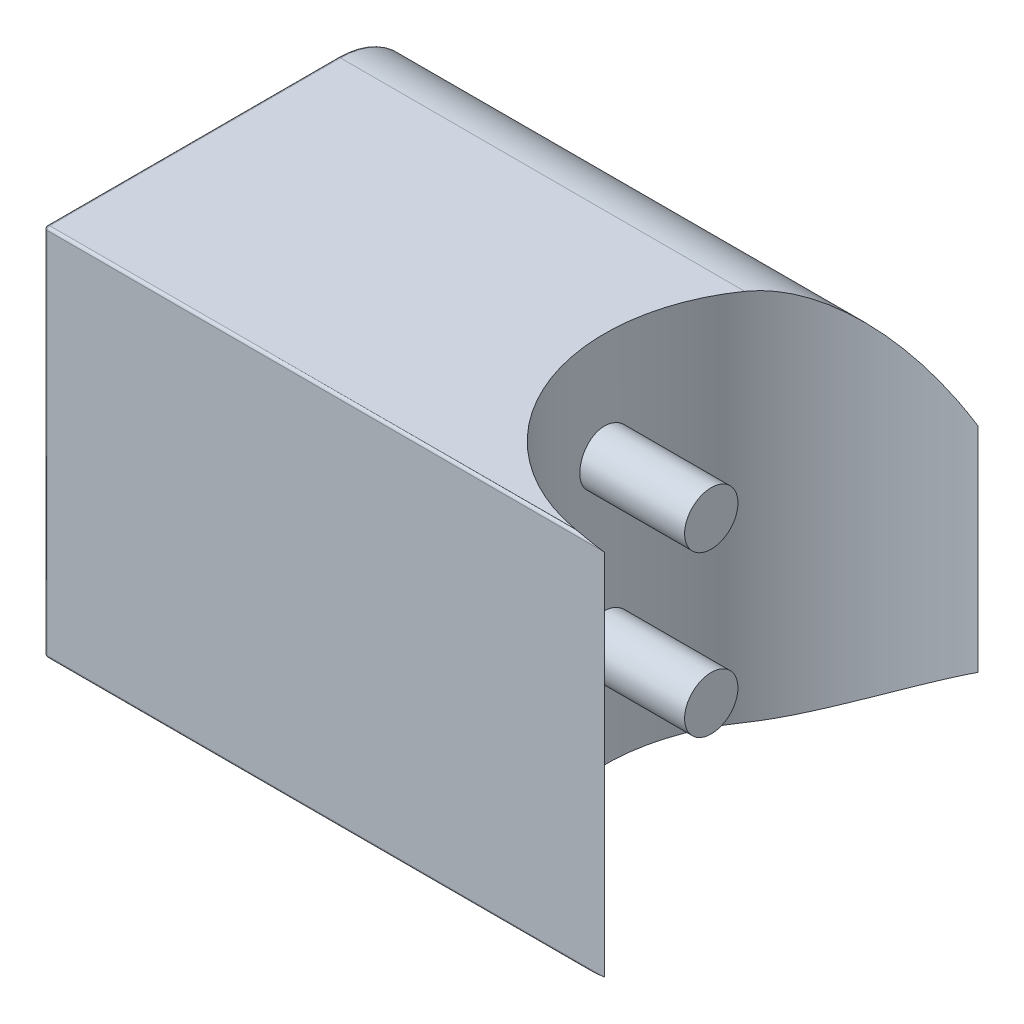
from build123d import *

# Parameters (mm, degrees)
SKETCH1_W           = 140
SKETCH1_H           = 140
BOSS_EXTRUDE1_DEPTH = 140
SKETCH2_R           = 60
CUT_EXTRUDE1_DEPTH  = 130
CUT_EXTRUDE1_DRAFT  = -24
SKETCH3_R           = 10
BOSS_EXTRUDE2_DEPTH = 140
BOSS_EXTRUDE3_DEPTH = 140
SKETCH5_R           = 10
BOSS_EXTRUDE4_DEPTH = 40
FILLET1_R           = 30
FILLET2_R           = 1


with BuildPart() as part:
    # Sketch1 → Boss-Extrude1 (new body)
    with BuildSketch(Plane(origin=(0, 0, 0), x_dir=(0, 0, -1), z_dir=(1, 0, 0))):
        with Locations((70, -70)):
            Rectangle(SKETCH1_W, SKETCH1_H)
    extrude(amount=BOSS_EXTRUDE1_DEPTH)


with BuildPart() as cut_extrude1_tool:
    # Sketch2 → Cut-Extrude1 (with draft: the straight prism first)
    with BuildSketch(Plane.ZY):
        with Locations((-70, -70)):
            Circle(SKETCH2_R)
    extrude(amount=-CUT_EXTRUDE1_DEPTH)
    # Cut-Extrude1: the draft: its side faces are tilted about the plane it starts from
    cut_extrude1_sides = [cut_extrude1_tool.faces().sort_by_distance(p)[0] for p in [
        (65, -70, -130),
    ]]
    draft(cut_extrude1_sides, Plane.ZY, CUT_EXTRUDE1_DRAFT)


with BuildPart() as part_1:
    add(part.part)

    # Cut-Extrude1: cut by cut_extrude1_tool
    add(cut_extrude1_tool.part, mode=Mode.SUBTRACT)

    # Sketch3 → Boss-Extrude2 (add)
    with BuildSketch(Plane.XY):
        with Locations((20, -70)):
            Circle(SKETCH3_R)
    extrude(amount=-BOSS_EXTRUDE2_DEPTH)

    # Sketch4 → Boss-Extrude3 (add)
    with BuildSketch(Plane(origin=(0, -140, 0), x_dir=(-1, 0, 0), z_dir=(0, -1, 0))):
        with BuildLine():
            ThreePointArc((-210, 140), (-160.502525317, 119.497474683), (-140, 70))
            Line((-140, 70), (-140, 140))
            Line((-140, 140), (-210, 140))
        make_face()
        with BuildLine():
            Line((-210, 0), (-140, 0))
            Line((-140, 0), (-140, 70))
            ThreePointArc((-140, 70), (-160.502525317, 20.502525317), (-210, 0))
        make_face()
    extrude(amount=-BOSS_EXTRUDE3_DEPTH)

    # Sketch5 → Boss-Extrude4 (add)
    with BuildSketch(Plane(origin=(140, 0, 0), x_dir=(0, 0, -1), z_dir=(1, 0, 0))):
        with Locations(Location((70, -100, 0), (0, 0, 180))):
            Circle(SKETCH5_R)
        with Locations(Location((70, -40, 0), (0, 0, 180))):
            Circle(SKETCH5_R)
    extrude(amount=BOSS_EXTRUDE4_DEPTH)

    # Fillet1
    fillet1_edges = [part_1.edges().sort_by_distance(p)[0] for p in [
        (105, 0, -140),
        (105, -140, -140),
    ]]
    fillet(fillet1_edges, radius=FILLET1_R)

    # Fillet2
    fillet2_edges = [part_1.edges().sort_by_distance(p)[0] for p in [
        (0, -140, -55),
        (0, -70, 0),
        (0, 0, -55),
        (0, -70, -140),
        (0, -131.213203436, -131.213203436),
        (0, -8.786796564, -131.213203436),
        (105, 0, 0),
        (105, -140, 0),
    ]]
    fillet(fillet2_edges, radius=FILLET2_R)


solid = part_1.part
